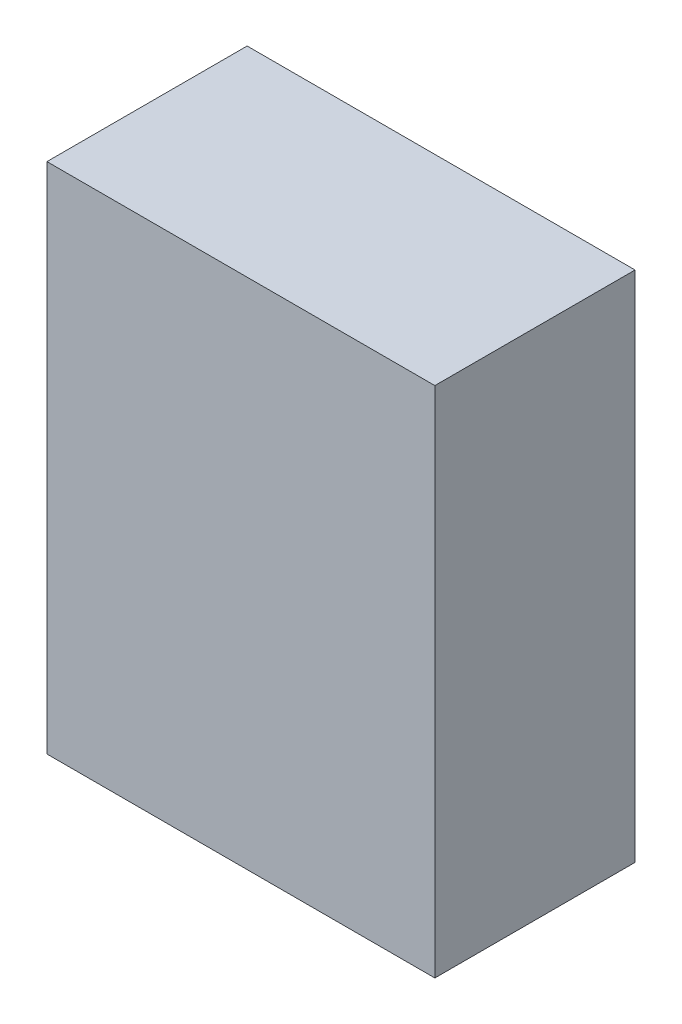
from build123d import *

# Parameters (mm, degrees)
CROQUIS1_W              = 620
CROQUIS1_H              = 820
CROQUIS1_W_2            = 600
CROQUIS1_H_2            = 800
SALIENTE_EXTRUIR1_DEPTH = 300
CROQUIS6_W              = 620
CROQUIS6_H              = 820
SALIENTE_EXTRUIR4_DEPTH = 20


with BuildPart() as part:
    # Croquis1 → Saliente-Extruir1 (new body)
    with BuildSketch(Plane.XY):
        with Locations((300, -400)):
            Rectangle(CROQUIS1_W, CROQUIS1_H)
        with Locations((300, -400)):
            Rectangle(CROQUIS1_W_2, CROQUIS1_H_2, mode=Mode.SUBTRACT)
    extrude(amount=SALIENTE_EXTRUIR1_DEPTH)

    # Croquis6 → Saliente-Extruir4 (add)
    with BuildSketch(Plane.XY.offset(300)):
        with Locations((300, -400)):
            Rectangle(CROQUIS6_W, CROQUIS6_H)
    extrude(amount=SALIENTE_EXTRUIR4_DEPTH)


solid = part.part
